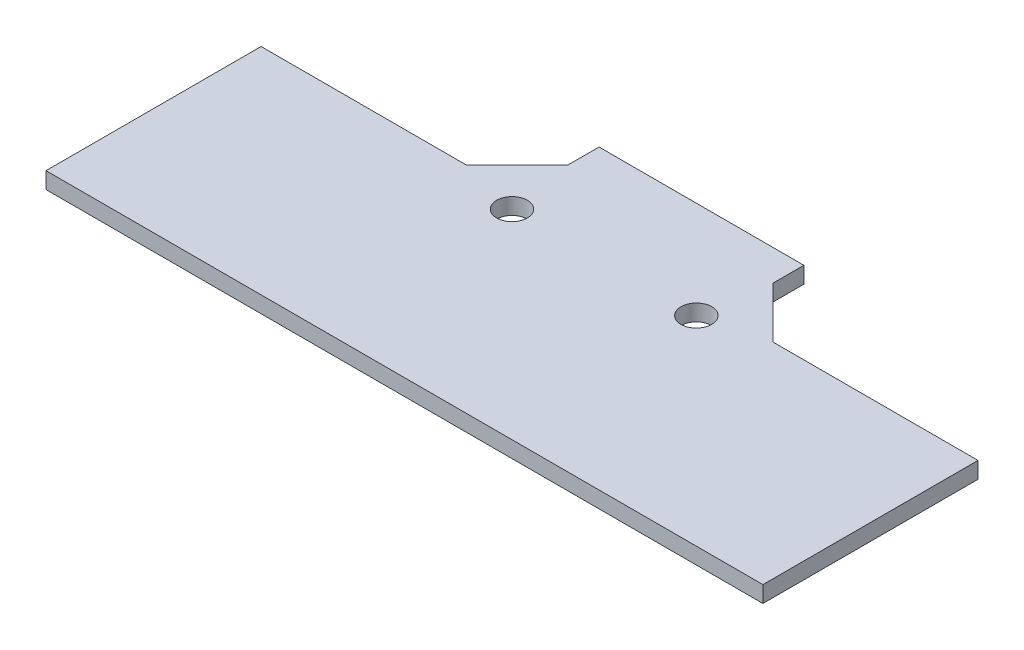
from build123d import *

# Parameters (mm, degrees)
SKETCH_1_R      = 1.5
EXTRUDE_1_DEPTH = 1.6


with BuildPart() as part:
    # 草图1 → 凸台-拉伸1 (new body)
    with BuildSketch(Plane(origin=(0, 0, 0), x_dir=(1, 0, 0), z_dir=(0, 1, 0))):
        Polygon((-9.701583435, 20.645554202), (-14.701583435, 15.645554202), (-34.701583435, 15.645554202), (-34.701583435, -5.354445798), (35.298416565, -5.354445798), (35.298416565, 15.645554202), (15.298416565, 15.645554202), (10.298416565, 20.645554202), (10.298416565, 23.645554202), (-9.701583435, 23.645554202), align=None)
        with Locations(Location((-8.701583435, 14.145554202, 0), (0, 0, 270))):
            Circle(SKETCH_1_R, mode=Mode.SUBTRACT)
        with Locations(Location((9.298416565, 14.145554202, 0), (0, 0, 270))):
            Circle(SKETCH_1_R, mode=Mode.SUBTRACT)
    extrude(amount=EXTRUDE_1_DEPTH)


solid = part.part
